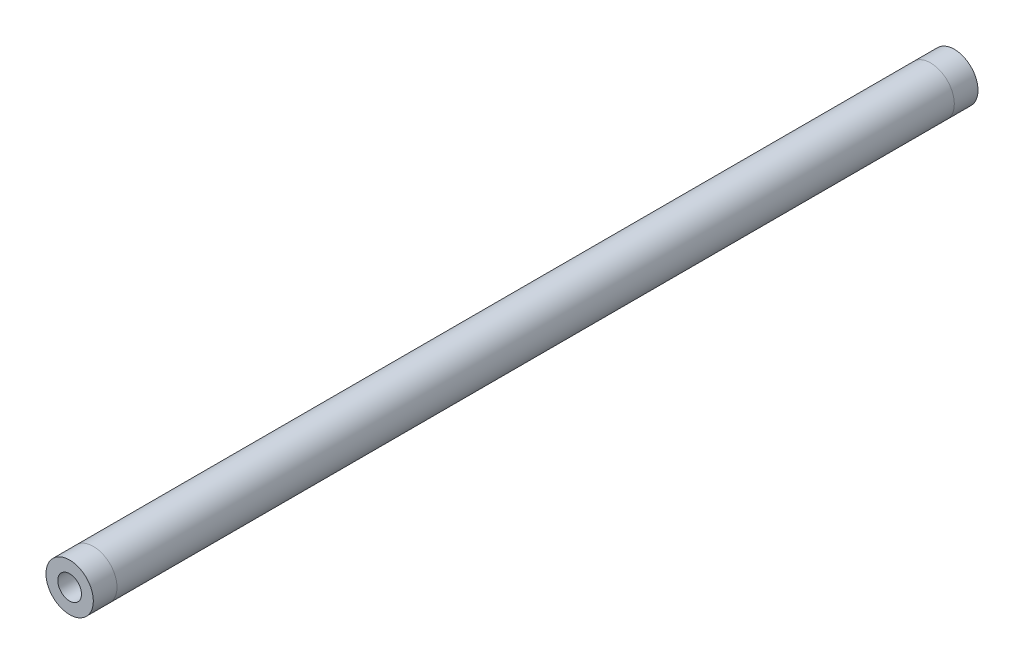
from build123d import *

# Parameters (mm, degrees)
SKETCH1_R                 = 6.35
SKETCH1_R_2               = 4.826
SKETCH1_R_3               = 3.175
THREADED_INSERT_1_1_DEPTH = 6.35
THREADED_START            = -6.35
SKETCH1_3_R               = 4.826
SKETCH1_3_R_2             = 3.175
THREADED_INSERT_1_2_DEPTH = 9.525
TUBE_START                = -6.35
SKETCH1_4_R               = 6.35
SKETCH1_4_R_2             = 4.826
TUBE_EXTRUDE_DEPTH        = 224.50563
THREADED_START_2          = -230.85563
SKETCH1_6_R               = 4.826
SKETCH1_6_R_2             = 3.175
THREADED_INSERT_2_1_DEPTH = 9.525
SKETCH1_9_R               = 6.35
SKETCH1_9_R_2             = 4.826
SKETCH1_9_R_3             = 3.175
THREADED_INSERT_2_2_DEPTH = 6.35


with BuildPart() as part:
    # Sketch1 → Threaded insert 1-1 (new body)
    # profile 1 of 2: a face of its own
    with BuildSketch(Plane.XY):
        Circle(SKETCH1_R)
        Circle(SKETCH1_R_2, mode=Mode.SUBTRACT)
    # profile 2 of 2: a face of its own
    with BuildSketch(Plane.XY):
        Circle(SKETCH1_R_2)
        Circle(SKETCH1_R_3, mode=Mode.SUBTRACT)
    extrude(amount=-THREADED_INSERT_1_1_DEPTH)

    # Sketch1<3> → Threaded insert 1-2 (add)
    with BuildSketch(Plane.XY.offset(THREADED_START)):
        Circle(SKETCH1_3_R)
        Circle(SKETCH1_3_R_2, mode=Mode.SUBTRACT)
    extrude(amount=-THREADED_INSERT_1_2_DEPTH)


with BuildPart() as body_2:
    # Sketch1<4> → Tube extrude (new body)
    with BuildSketch(Plane.XY.offset(TUBE_START)):
        Circle(SKETCH1_4_R)
        Circle(SKETCH1_4_R_2, mode=Mode.SUBTRACT)
    extrude(amount=-TUBE_EXTRUDE_DEPTH)


with BuildPart() as body_3:
    # Sketch1<6> → Threaded insert 2-1 (new body)
    with BuildSketch(Plane.XY.offset(THREADED_START_2)):
        Circle(SKETCH1_6_R)
        Circle(SKETCH1_6_R_2, mode=Mode.SUBTRACT)
    extrude(amount=THREADED_INSERT_2_1_DEPTH)


with BuildPart() as body_4:
    # Sketch1<9> → Threaded insert 2-2 (new body)
    # profile 1 of 2: a face of its own
    with BuildSketch(Plane.XY.offset(THREADED_START_2)):
        Circle(SKETCH1_9_R)
        Circle(SKETCH1_9_R_2, mode=Mode.SUBTRACT)
    # profile 2 of 2: a face of its own
    with BuildSketch(Plane.XY.offset(THREADED_START_2)):
        Circle(SKETCH1_9_R_2)
        Circle(SKETCH1_9_R_3, mode=Mode.SUBTRACT)
    extrude(amount=-THREADED_INSERT_2_2_DEPTH)

    # Combine1: union body 3
    add(body_3.part)


solid = Compound([part.part, body_2.part, body_4.part])
